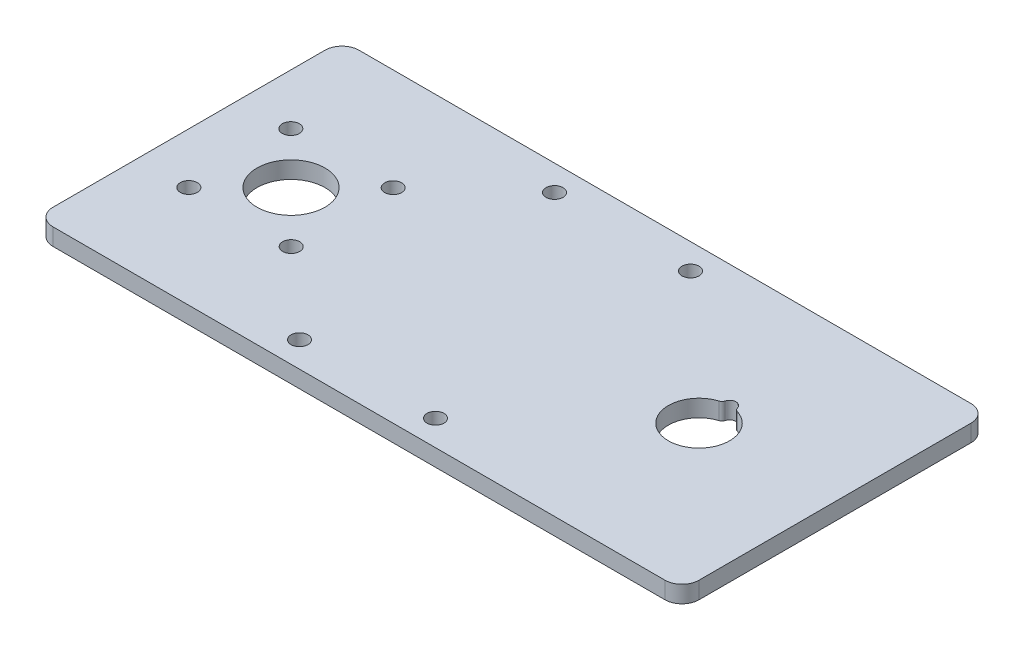
from build123d import *

# Parameters (mm, degrees)
SKETCH1_W           = 241.3
SKETCH1_H           = 114.3
SKETCH1_R           = 12.7
SKETCH1_R_2         = 3.175
BOSS_EXTRUDE1_DEPTH = 6.35
FILLET1_R           = 6.35
FILLET2_R           = 1.5875


with BuildPart() as part:
    # Sketch1 → Boss-Extrude1 (new body)
    with BuildSketch(Plane(origin=(0, 0, 0), x_dir=(1, 0, 0), z_dir=(0, 1, 0))):
        with Locations((120.65, 57.15)):
            Rectangle(SKETCH1_W, SKETCH1_H)
        with Locations(Location((38.1, 57.15, 0), (0, 0, 270))):
            Circle(SKETCH1_R, mode=Mode.SUBTRACT)
        with Locations(Location((88.9, 104.775, 0), (0, 0, 270))):
            Circle(SKETCH1_R_2, mode=Mode.SUBTRACT)
        with Locations(Location((139.7, 104.775, 0), (0, 0, 270))):
            Circle(SKETCH1_R_2, mode=Mode.SUBTRACT)
        with Locations(Location((139.7, 9.525, 0), (0, 0, 270))):
            Circle(SKETCH1_R_2, mode=Mode.SUBTRACT)
        with Locations(Location((88.9, 9.525, 0), (0, 0, 270))):
            Circle(SKETCH1_R_2, mode=Mode.SUBTRACT)
        with Locations(Location((18.983968606, 76.2, 0), (0, 0, 270))):
            Circle(SKETCH1_R_2, mode=Mode.SUBTRACT)
        with Locations(Location((18.983968606, 38.1, 0), (0, 0, 270))):
            Circle(SKETCH1_R_2, mode=Mode.SUBTRACT)
        with Locations(Location((57.216031394, 38.1, 0), (0, 0, 270))):
            Circle(SKETCH1_R_2, mode=Mode.SUBTRACT)
        with Locations(Location((57.216031394, 76.2, 0), (0, 0, 270))):
            Circle(SKETCH1_R_2, mode=Mode.SUBTRACT)
        with BuildLine():
            ThreePointArc((188.131704345, 68.331953125), (190.5, 45.72), (192.868295655, 68.331953125))
            ThreePointArc((192.868295655, 68.331953125), (190.5, 70.96125), (188.131704345, 68.331953125))
        make_face(mode=Mode.SUBTRACT)
    extrude(amount=BOSS_EXTRUDE1_DEPTH)

    # Fillet1
    fillet1_edges = [part.edges().sort_by_distance(p)[0] for p in [
        (0, 3.175, -114.3),
        (241.3, 3.175, -114.3),
        (241.3, 3.175, 0),
        (0, 3.175, 0),
    ]]
    fillet(fillet1_edges, radius=FILLET1_R)

    # Fillet2
    fillet2_edges = [part.edges().sort_by_distance(p)[0] for p in [
        (192.868295655, 3.175, -68.331953125),
        (188.131704345, 3.175, -68.331953125),
    ]]
    fillet(fillet2_edges, radius=FILLET2_R)


solid = part.part
